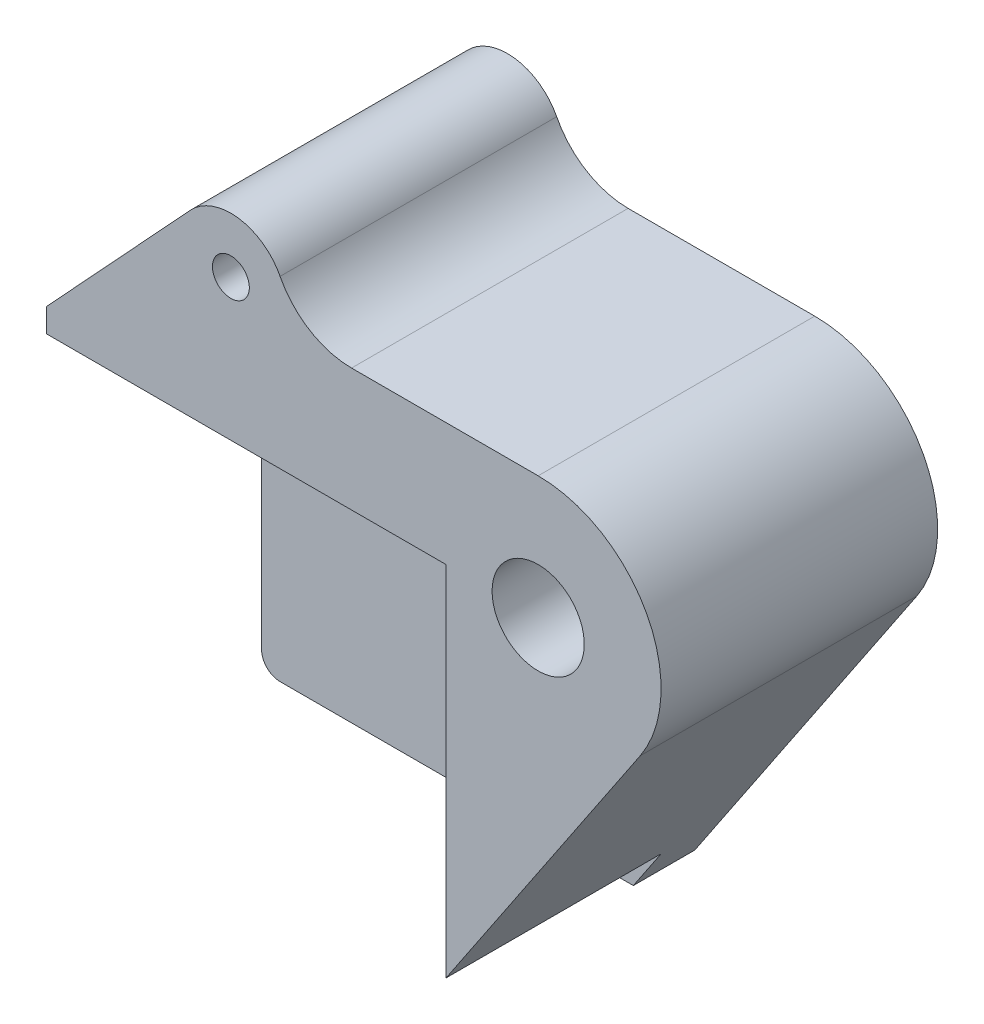
from build123d import *

# Parameters (mm, degrees)
SKETCH_1_R          = 3
SKETCH_1_R_2        = 7.5
EXTRUDE_2_DEPTH     = 45
SKETCH_3_W          = 65
SKETCH_3_H          = 65
CUT_EXTRUDE_1_DEPTH = 35
FILLET_1_R          = 3


with BuildPart() as part:
    # ｽｹｯﾁ1 → ﾎﾞｽ - 押し出し2 (new body)
    with BuildSketch(Plane.XY):
        with BuildLine():
            Line((0, 0), (60.482195673, 0))
            Line((60.482195673, 0), (96.609428685, 53.858775707))
            ThreePointArc((96.609428685, 53.858775707), (97.646876294, 74.412106941), (80, 85))
            Line((80, 85), (49.635590302, 85))
            ThreePointArc((49.635590302, 85), (42.822728652, 86.91697026), (38.00913265, 92.105337282))
            ThreePointArc((38.00913265, 92.105337282), (31.226913615, 96.915979081), (23.397413698, 94.116032547))
            Line((23.397413698, 94.116032547), (0, 68.857265202))
            Line((0, 68.857265202), (0, 0))
        make_face()
        with Locations(Location((30, 88, 0), (0, 0, 180))):
            Circle(SKETCH_1_R, mode=Mode.SUBTRACT)
        with Locations(Location((80, 65, 0), (0, 0, 180))):
            Circle(SKETCH_1_R_2, mode=Mode.SUBTRACT)
    extrude(amount=EXTRUDE_2_DEPTH)

    # ｽｹｯﾁ3 → ｶｯﾄ - 押し出し1 (cut)
    with BuildSketch(Plane.XY.offset(45)):
        with Locations((32.5, 32.5)):
            Rectangle(SKETCH_3_W, SKETCH_3_H)
    extrude(amount=-CUT_EXTRUDE_1_DEPTH, mode=Mode.SUBTRACT)

    # ﾌｨﾚｯﾄ1
    fillet_1_edges = [part.edges().sort_by_distance(p)[0] for p in [
        (0, 0, 5),
    ]]
    fillet(fillet_1_edges, radius=FILLET_1_R)


solid = part.part
